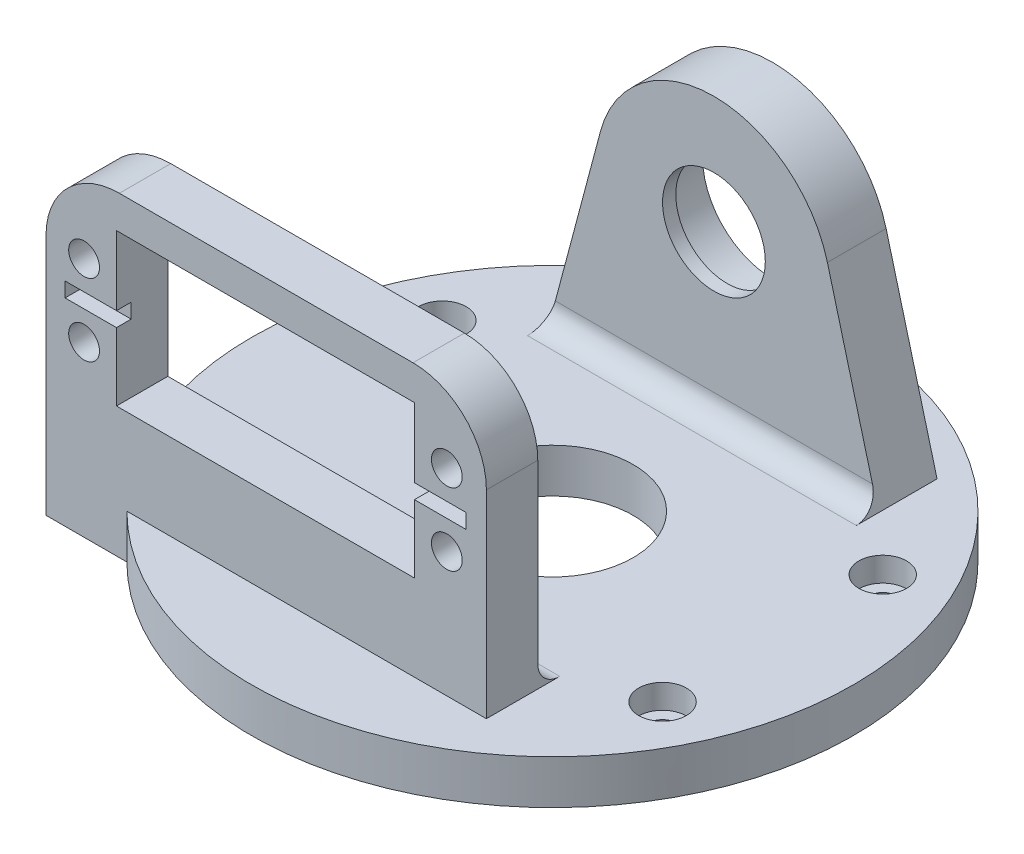
from build123d import *

# Parameters (mm, degrees)
SKETCH1_R           = 41
BOSS_EXTRUDE1_DEPTH = 6
BOSS_EXTRUDE2_DEPTH = 8
BOSS_EXTRUDE3_DEPTH = 7
SKETCH4_W           = 40.6
SKETCH4_H           = 20.7
CUT_EXTRUDE1_DEPTH  = 7
SKETCH5_R           = 9.55
CUT_EXTRUDE2_DEPTH  = 6.2
SKETCH6_R           = 7
CUT_EXTRUDE3_DEPTH  = 8
SKETCH7_R           = 11
SKETCH7_R_2         = 1.7
CUT_EXTRUDE4_DEPTH  = 6
SKETCH8_R           = 3.25
CUT_EXTRUDE6_DEPTH  = 3.3
SKETCH10_R          = 2.1
CUT_EXTRUDE8_DEPTH  = 5.5
FILLET1_R           = 3
CHAMFER1_SIZE       = 0.8
SKETCH11_W          = 7.2
SKETCH11_H          = 2
CUT_EXTRUDE9_DEPTH  = 2


with BuildPart() as part:
    # Sketch1 → Boss-Extrude1 (new body)
    with BuildSketch(Plane(origin=(0, 0, 0), x_dir=(1, 0, 0), z_dir=(0, 1, 0))):
        with Locations(Location((0, 0, 0), (0, 0, 270))):
            Circle(SKETCH1_R)
    extrude(amount=BOSS_EXTRUDE1_DEPTH)

    # Sketch2 → Boss-Extrude2 (add)
    with BuildSketch(Plane.XY.offset(-30)):
        with BuildLine():
            Line((-24, 0), (24, 0))
            Line((24, 0), (15.461253, 32.066997))
            ThreePointArc((15.461253, 32.066997), (0, 43.95000027), (-15.461253, 32.066997))
            Line((-15.461253, 32.066997), (-24, 0))
        make_face()
    extrude(amount=BOSS_EXTRUDE2_DEPTH)

    # Sketch3 → Boss-Extrude3 (add)
    with BuildSketch(Plane.XY.offset(22)):
        with BuildLine():
            Line((-40, 0), (20, 0))
            Line((20, 0), (20, 33))
            ThreePointArc((20, 33), (17.071067812, 40.071067812), (10, 43))
            Line((10, 43), (-30, 43))
            ThreePointArc((-30, 43), (-37.071067812, 40.071067812), (-40, 33))
            Line((-40, 33), (-40, 0))
        make_face()
    extrude(amount=BOSS_EXTRUDE3_DEPTH)

    # Sketch4 → Cut-Extrude1 (cut)
    with BuildSketch(Plane.XY.offset(22)):
        with Locations((-10.1, 28.05)):
            Rectangle(SKETCH4_W, SKETCH4_H)
    extrude(amount=CUT_EXTRUDE1_DEPTH, mode=Mode.SUBTRACT)

    # Sketch5 → Cut-Extrude2 (cut)
    with BuildSketch(Plane.XY.offset(-30)):
        with Locations(Location((0, 27.95, 0), (0, 0, 180))):
            Circle(SKETCH5_R)
    extrude(amount=CUT_EXTRUDE2_DEPTH, mode=Mode.SUBTRACT)

    # Sketch6 → Cut-Extrude3 (cut)
    with BuildSketch(Plane.XY.offset(-30)):
        with Locations((0, 27.95)):
            Circle(SKETCH6_R)
    extrude(amount=CUT_EXTRUDE3_DEPTH, mode=Mode.SUBTRACT)

    # Sketch7 → Cut-Extrude4 (cut)
    with BuildSketch(Plane(origin=(0, 0, 0), x_dir=(1, 0, 0), z_dir=(0, 1, 0))):
        with Locations(Location((0, 0, 0), (0, 0, 270))):
            Circle(SKETCH7_R)
        with Locations(Location((30, 15, 0), (0, 0, 270))):
            Circle(SKETCH7_R_2)
        with Locations(Location((30, -15, 0), (0, 0, 270))):
            Circle(SKETCH7_R_2)
        with Locations(Location((-30, 15, 0), (0, 0, 270))):
            Circle(SKETCH7_R_2)
        with Locations(Location((-30, -15, 0), (0, 0, 270))):
            Circle(SKETCH7_R_2)
    extrude(amount=CUT_EXTRUDE4_DEPTH, mode=Mode.SUBTRACT)

    # Sketch8 → Cut-Extrude6 (cut)
    with BuildSketch(Plane(origin=(0, 6, 0), x_dir=(1, 0, 0), z_dir=(0, 1, 0))):
        with Locations(Location((30, 15, 0), (0, 0, 270))):
            Circle(SKETCH8_R)
        with Locations(Location((30, -15, 0), (0, 0, 270))):
            Circle(SKETCH8_R)
        with Locations(Location((-30, 15, 0), (0, 0, 270))):
            Circle(SKETCH8_R)
        with Locations(Location((-30, -15, 0), (0, 0, 270))):
            Circle(SKETCH8_R)
    extrude(amount=-CUT_EXTRUDE6_DEPTH, mode=Mode.SUBTRACT)

    # Sketch10 → Cut-Extrude8 (cut)
    with BuildSketch(Plane.XY.offset(29)):
        with Locations((-34.811, 23.025)):
            Circle(SKETCH10_R)
        with Locations((-34.811, 32.875)):
            Circle(SKETCH10_R)
        with Locations((14.611, 23.025)):
            Circle(SKETCH10_R)
        with Locations((14.611, 32.875)):
            Circle(SKETCH10_R)
    extrude(amount=-CUT_EXTRUDE8_DEPTH, mode=Mode.SUBTRACT)

    # Fillet1
    fillet1_edges = [part.edges().sort_by_distance(p)[0] for p in [
        (0, 6, -22),
        (-7.298843892, 6, 22),
    ]]
    fillet(fillet1_edges, radius=FILLET1_R)

    # Chamfer1
    chamfer1_edges = [part.edges().sort_by_distance(p)[0] for p in [
        (-30, 0, 13.3),
        (-30, 0, -16.7),
        (30, 0, 13.3),
        (30, 0, -16.7),
    ]]
    chamfer(chamfer1_edges, length=CHAMFER1_SIZE)

    # Sketch11 → Cut-Extrude9 (cut)
    with BuildSketch(Plane.XY.offset(29)):
        with Locations((-33.8, 27.95)):
            Rectangle(SKETCH11_W, SKETCH11_H)
        with Locations((13.6, 27.95)):
            Rectangle(SKETCH11_W, SKETCH11_H)
    extrude(amount=-CUT_EXTRUDE9_DEPTH, mode=Mode.SUBTRACT)


solid = part.part
